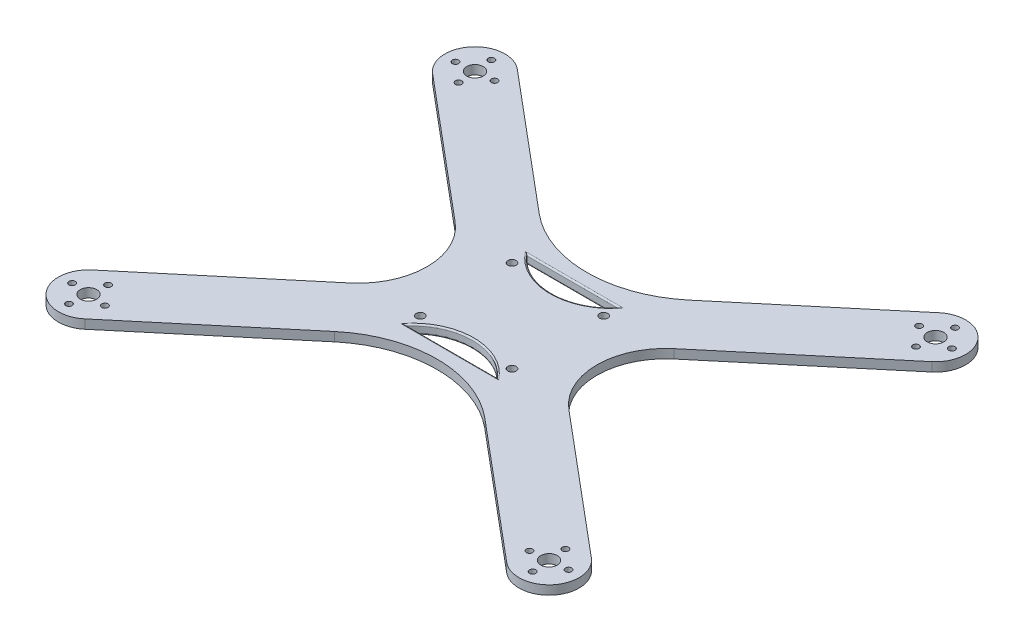
from build123d import *

# Parameters (mm, degrees)
SKETCH2_R           = 1.05
SKETCH2_R_2         = 2.75
BOSS_EXTRUDE2_DEPTH = 3
SKETCH4_R           = 1.375
CUT_EXTRUDE1_DEPTH  = 3
CUT_EXTRUDE2_DEPTH  = 3
FILLET3_R           = 0.5


with BuildPart() as part:
    # Sketch2 → Boss-Extrude2 (new body)
    with BuildSketch(Plane(origin=(0, 0, 0), x_dir=(1, 0, 0), z_dir=(0, 1, 0))):
        with BuildLine():
            Line((-83.032320409, 56.618316537), (-36.412926139, 17.5))
            ThreePointArc((-36.412926139, 17.5), (-28.252542121, 0), (-36.412926139, -17.5))
            Line((-36.412926139, -17.5), (-83.032320409, -56.618316537))
            ThreePointArc((-83.032320409, -56.618316537), (-84.264888743, -70.706637066), (-70.176568215, -71.9392054))
            Line((-70.176568215, -71.9392054), (-25, -34.031563673))
            ThreePointArc((-25, -34.031563673), (0, -24.932307816), (25, -34.031563673))
            Line((25, -34.031563673), (70.176568215, -71.9392054))
            ThreePointArc((70.176568215, -71.9392054), (84.264888743, -70.706637066), (83.032320409, -56.618316537))
            Line((83.032320409, -56.618316537), (36.412926139, -17.5))
            ThreePointArc((36.412926139, -17.5), (28.252542121, 0), (36.412926139, 17.5))
            Line((36.412926139, 17.5), (83.032320409, 56.618316537))
            ThreePointArc((83.032320409, 56.618316537), (84.264888743, 70.706637066), (70.176568215, 71.9392054))
            Line((70.176568215, 71.9392054), (25, 34.031563673))
            ThreePointArc((25, 34.031563673), (0, 24.932307816), (-25, 34.031563673))
            Line((-25, 34.031563673), (-70.176568215, 71.9392054))
            ThreePointArc((-70.176568215, 71.9392054), (-84.264888743, 70.706637066), (-83.032320409, 56.618316537))
        make_face()
        with Locations(Location((-77.127378768, 70.255929157, 0), (0, 0, 270))):
            Circle(SKETCH2_R, mode=Mode.SUBTRACT)
        with Locations(Location((-70.627276123, 64.801695425, 0), (0, 0, 270))):
            Circle(SKETCH2_R, mode=Mode.SUBTRACT)
        with Locations(Location((-76.081509855, 58.30159278, 0), (0, 0, 270))):
            Circle(SKETCH2_R, mode=Mode.SUBTRACT)
        with Locations(Location((-82.5816125, 63.755826512, 0), (0, 0, 270))):
            Circle(SKETCH2_R, mode=Mode.SUBTRACT)
        with Locations(Location((-76.604444312, 64.278760969, 0), (0, 0, 270))):
            Circle(SKETCH2_R_2, mode=Mode.SUBTRACT)
        with Locations(Location((-77.127378768, -70.255929157, 0), (0, 0, 90))):
            Circle(SKETCH2_R, mode=Mode.SUBTRACT)
        with Locations(Location((-76.081509855, -58.30159278, 0), (0, 0, 90))):
            Circle(SKETCH2_R, mode=Mode.SUBTRACT)
        with Locations(Location((-82.5816125, -63.755826512, 0), (0, 0, 90))):
            Circle(SKETCH2_R, mode=Mode.SUBTRACT)
        with Locations(Location((-76.604444312, -64.278760969, 0), (0, 0, 90))):
            Circle(SKETCH2_R_2, mode=Mode.SUBTRACT)
        with Locations(Location((-70.627276123, -64.801695425, 0), (0, 0, 90))):
            Circle(SKETCH2_R, mode=Mode.SUBTRACT)
        with Locations(Location((70.627276123, -64.801695425, 0), (0, 0, 270))):
            Circle(SKETCH2_R, mode=Mode.SUBTRACT)
        with Locations(Location((76.604444312, -64.278760969, 0), (0, 0, 270))):
            Circle(SKETCH2_R_2, mode=Mode.SUBTRACT)
        with Locations(Location((82.5816125, -63.755826512, 0), (0, 0, 270))):
            Circle(SKETCH2_R, mode=Mode.SUBTRACT)
        with Locations(Location((76.081509855, -58.30159278, 0), (0, 0, 270))):
            Circle(SKETCH2_R, mode=Mode.SUBTRACT)
        with Locations(Location((77.127378768, -70.255929157, 0), (0, 0, 270))):
            Circle(SKETCH2_R, mode=Mode.SUBTRACT)
        with Locations(Location((76.604444312, 64.278760969, 0), (0, 0, 90))):
            Circle(SKETCH2_R_2, mode=Mode.SUBTRACT)
        with Locations(Location((82.5816125, 63.755826512, 0), (0, 0, 90))):
            Circle(SKETCH2_R, mode=Mode.SUBTRACT)
        with Locations(Location((76.081509855, 58.30159278, 0), (0, 0, 90))):
            Circle(SKETCH2_R, mode=Mode.SUBTRACT)
        with Locations(Location((70.627276123, 64.801695425, 0), (0, 0, 90))):
            Circle(SKETCH2_R, mode=Mode.SUBTRACT)
        with Locations(Location((77.127378768, 70.255929157, 0), (0, 0, 90))):
            Circle(SKETCH2_R, mode=Mode.SUBTRACT)
    extrude(amount=BOSS_EXTRUDE2_DEPTH)

    # Sketch4 → Cut-Extrude1 (cut)
    with BuildSketch(Plane(origin=(0, 0, 0), x_dir=(1, 0, 0), z_dir=(0, 1, 0))):
        with Locations(Location((-15.25, 15.25, 0), (0, 0, 270))):
            Circle(SKETCH4_R)
        with Locations(Location((15.25, -15.25, 0), (0, 0, 270))):
            Circle(SKETCH4_R)
        with Locations(Location((-15.25, -15.25, 0), (0, 0, 270))):
            Circle(SKETCH4_R)
        with Locations(Location((15.25, 15.25, 0), (0, 0, 270))):
            Circle(SKETCH4_R)
    extrude(amount=CUT_EXTRUDE1_DEPTH, mode=Mode.SUBTRACT)

    # Sketch5 → Cut-Extrude2 (cut)
    with BuildSketch(Plane(origin=(0, 3, 0), x_dir=(1, 0, 0), z_dir=(0, 1, 0))):
        with BuildLine():
            Line((-15.25, 20.25), (15.25, 20.25))
            ThreePointArc((15.25, 20.25), (0, 13.189764295), (-15.25, 20.25))
        make_face()
        with BuildLine():
            Line((-15.25, -20.25), (15.25, -20.25))
            ThreePointArc((15.25, -20.25), (0, -13.189764295), (-15.25, -20.25))
        make_face()
    extrude(amount=-CUT_EXTRUDE2_DEPTH, mode=Mode.SUBTRACT)

    # Fillet3
    fillet3_edges = [part.edges().sort_by_distance(p)[0] for p in [
        (0, 0, -13.189764295),
        (0, 0, -20.25),
        (0, 3, -13.189764295),
        (0, 3, -20.25),
        (0, 0, 13.189764295),
        (0, 0, 20.25),
        (0, 3, 13.189764295),
        (0, 3, 20.25),
    ]]
    fillet(fillet3_edges, radius=FILLET3_R)


solid = part.part
